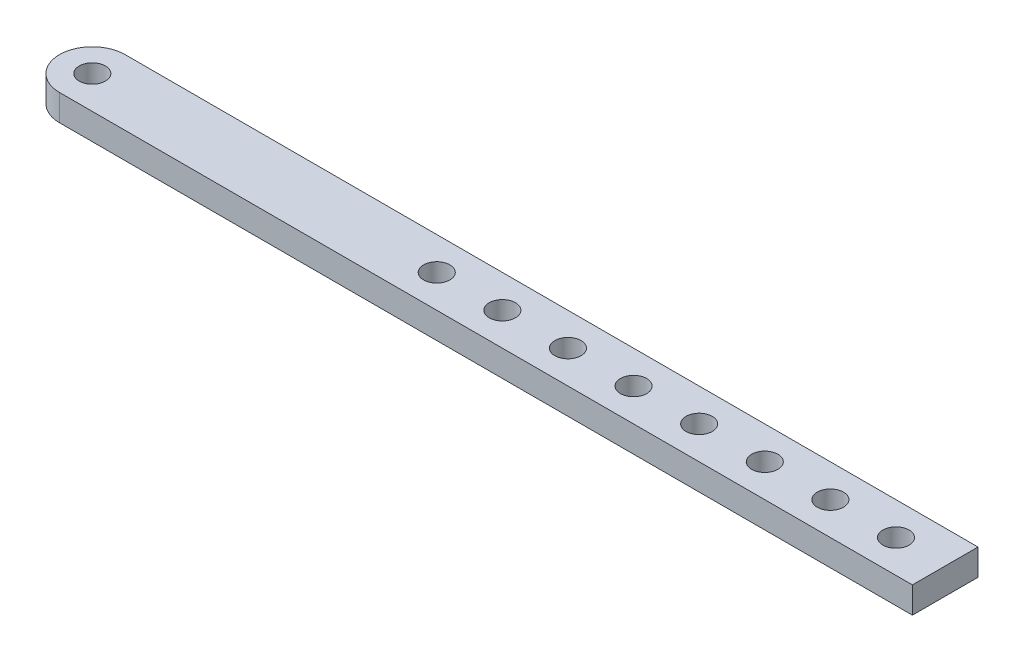
from build123d import *

# Parameters (mm, degrees)
BOSS_EXTRUDE1_DEPTH = 8
SKETCH2_R           = 4
CUT_EXTRUDE1_DEPTH  = 8
SKETCH3_R           = 4
CUT_EXTRUDE2_DEPTH  = 10
LPATTERN1_COUNT     = 8
LPATTERN1_PITCH     = 20


with BuildPart() as part:
    # Sketch1 → Boss-Extrude1 (new body)
    with BuildSketch(Plane(origin=(0, 0, 0), x_dir=(1, 0, 0), z_dir=(0, 1, 0))):
        with BuildLine():
            Line((0, 10), (260, 10))
            Line((260, 10), (260, -10))
            Line((260, -10), (0, -10))
            ThreePointArc((0, -10), (-10, 0), (0, 10))
        make_face()
    extrude(amount=BOSS_EXTRUDE1_DEPTH)

    # Sketch2 → Cut-Extrude1 (cut)
    with BuildSketch(Plane(origin=(0, 8, 0), x_dir=(1, 0, 0), z_dir=(0, 1, 0))):
        with Locations(Location((0, 0, 0), (0, 0, 270))):
            Circle(SKETCH2_R)
    extrude(amount=-CUT_EXTRUDE1_DEPTH, mode=Mode.SUBTRACT)

    # Sketch3 → Cut-Extrude2 (cut)
    with BuildSketch(Plane(origin=(0, 8, 0), x_dir=(1, 0, 0), z_dir=(0, 1, 0))):
        with Locations(Location((245, 0, 0), (0, 0, 270))):
            Circle(SKETCH3_R)
    cut_extrude2 = extrude(amount=-CUT_EXTRUDE2_DEPTH, mode=Mode.SUBTRACT)

    # LPattern1: Cut-Extrude2 ×8
    with Locations(*[(-i * LPATTERN1_PITCH, 0, 0) for i in range(1, LPATTERN1_COUNT)]):
        add(cut_extrude2, mode=Mode.SUBTRACT)


solid = part.part
